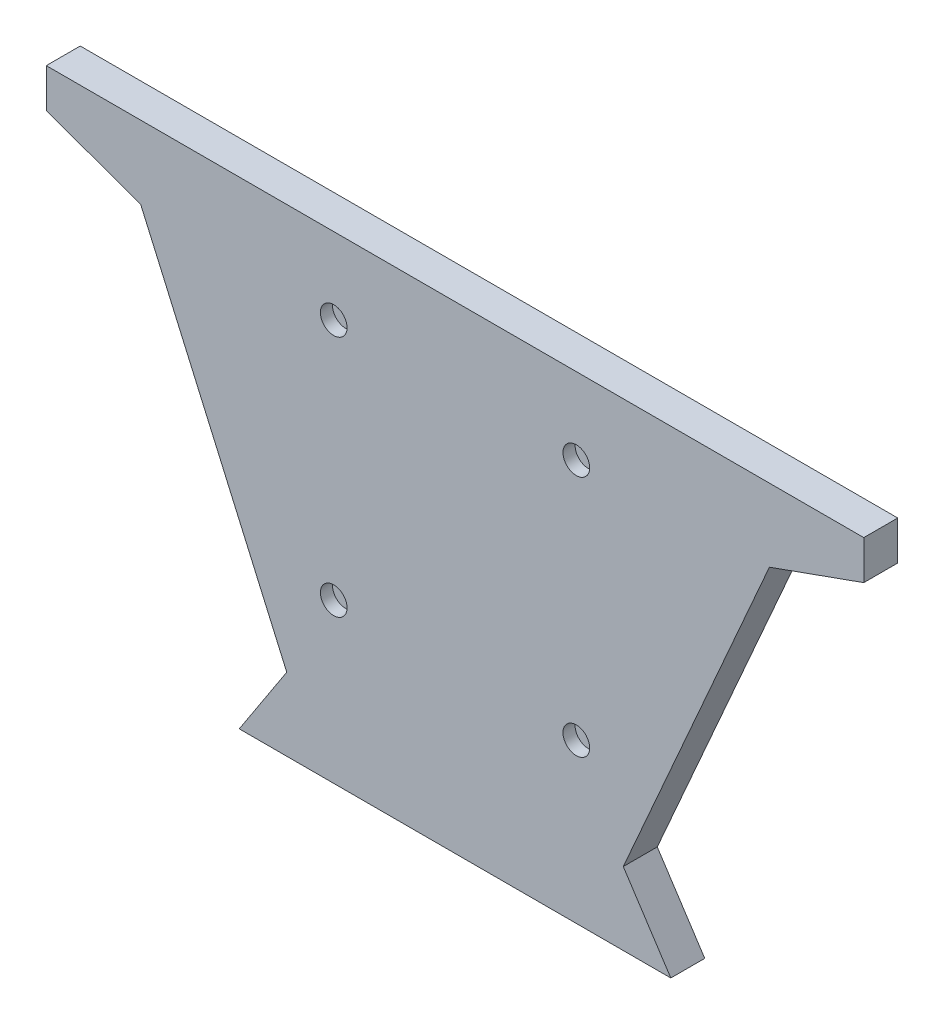
from build123d import *

# Parameters (mm, degrees)
BOSS_EXTRUDE1_DEPTH = 7
CUT_EXTRUDE1_DEPTH  = 10
SKETCH3_R           = 2.75
CUT_EXTRUDE2_DEPTH  = 2.5


with BuildPart() as part:
    # Sketch1 → Boss-Extrude1 (new body)
    with BuildSketch(Plane.XY):
        Polygon((-84.25, 41.208366892), (-44.473549128, -49.25), (44.473549128, -49.25), (84.25, 41.208366892), (84.25, 49.25), (-84.25, 49.25), align=None)
    extrude(amount=BOSS_EXTRUDE1_DEPTH)

    # Sketch2 → Cut-Extrude1 (cut)
    with BuildSketch(Plane(origin=(0, 0, 0), x_dir=(-1, 0, 0), z_dir=(0, 0, -1))):
        Polygon((44.473549128, -49.25), (34.683249526, -34.25), (64.804143572, 34.25), (84.25, 41.208366892), align=None)
        Polygon((-64.804143572, 34.25), (-34.683249526, -34.25), (-44.473549128, -49.25), (-84.25, 41.208366892), align=None)
    extrude(amount=-CUT_EXTRUDE1_DEPTH, mode=Mode.SUBTRACT)

    # Sketch3 → Cut-Extrude2 (cut)
    with BuildSketch(Plane.XY.offset(7)):
        with Locations((25, 33.446923075)):
            Circle(SKETCH3_R)
        with Locations((-25, 33.446923075)):
            Circle(SKETCH3_R)
        with Locations((-25, -16.553076925)):
            Circle(SKETCH3_R)
        with Locations((25, -16.553076925)):
            Circle(SKETCH3_R)
    cut_extrude2 = extrude(amount=-CUT_EXTRUDE2_DEPTH, mode=Mode.SUBTRACT)

    # Mirror1: Cut-Extrude2 across plane
    add(cut_extrude2.mirror(Plane(origin=(0, 0, 3.5), x_dir=(1, 0, 0), z_dir=(0, 0, -1))), mode=Mode.SUBTRACT)


solid = part.part
